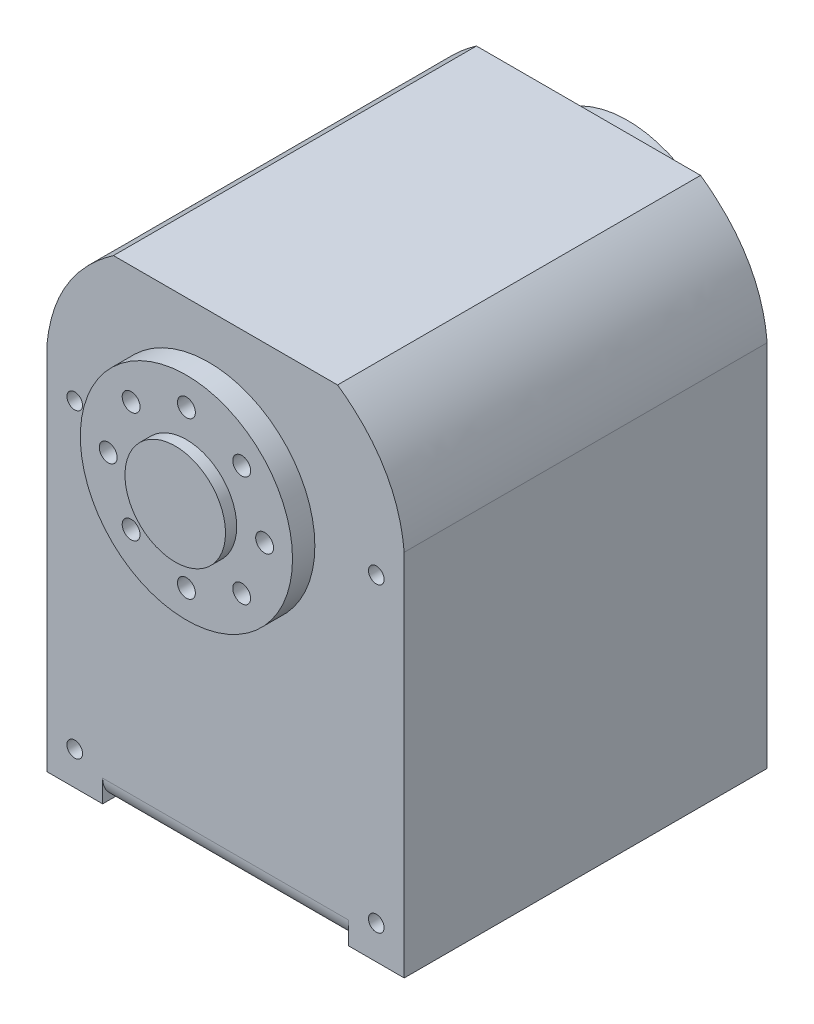
from build123d import *

# Parameters (mm, degrees)
ESQUISSE2_W             = 32
ESQUISSE2_H             = 43
BOSS_EXTRU_1_DEPTH      = 32.5
ESQUISSE3_R             = 0.7
ENL_V_MAT_EXTRU_1_DEPTH = 43.12481454
ESQUISSE4_R             = 4.5
BOSS_EXTRU_2_DEPTH      = 1.5
ESQUISSE5_R             = 9.5
ESQUISSE5_R_2           = 0.004347537
BOSS_EXTRU_3_DEPTH      = 2
ESQUISSE6_R             = 0.8
ENL_V_MAT_EXTRU_2_DEPTH = 2
ESQUISSE7_R             = 4.5
BOSS_EXTRU_4_DEPTH      = 1
ENL_V_MAT_EXTRU_4_DEPTH = 43.12481454
ENL_V_START             = -5
ENL_V_MAT_EXTRU_5_DEPTH = 22


with BuildPart() as part:
    # Esquisse2 → Boss.-Extru.1 (new body)
    with BuildSketch(Plane.XY):
        Rectangle(ESQUISSE2_W, ESQUISSE2_H)
    extrude(amount=BOSS_EXTRU_1_DEPTH)

    # Esquisse3 → Enlèv. mat.-Extru.1 (cut, through all)
    with BuildSketch(Plane.XY.offset(32.5)):
        with Locations((-13.5, -18.5)):
            Circle(ESQUISSE3_R)
        with Locations((-13.5, 8.5)):
            Circle(ESQUISSE3_R)
        with Locations(Location((13.5, 8.5, 0), (0, 0, 180))):
            Circle(ESQUISSE3_R)
        with Locations(Location((13.5, -18.5, 0), (0, 0, 180))):
            Circle(ESQUISSE3_R)
    extrude(amount=-ENL_V_MAT_EXTRU_1_DEPTH, mode=Mode.SUBTRACT)

    # Esquisse4 → Boss.-Extru.2 (add)
    with BuildSketch(Plane.XY.offset(32.5)):
        with Locations((0, 9.5)):
            Circle(ESQUISSE4_R)
    boss_extru_2 = extrude(amount=BOSS_EXTRU_2_DEPTH)

    # Esquisse5 → Boss.-Extru.3 (add)
    with BuildSketch(Plane.XY.offset(34)):
        with Locations((0, 9.5)):
            Circle(ESQUISSE5_R)
        with Locations((-2.77085543, 1.343871271)):
            Circle(ESQUISSE5_R_2, mode=Mode.SUBTRACT)
    boss_extru_3 = extrude(amount=BOSS_EXTRU_3_DEPTH)

    # Esquisse6 → Enlèv. mat.-Extru.2 (cut)
    with BuildSketch(Plane.XY.offset(36)):
        with Locations((-7, 9.5)):
            Circle(ESQUISSE6_R)
        with Locations((-4.949747468, 14.449747468)):
            Circle(ESQUISSE6_R)
        with Locations((0, 16.5)):
            Circle(ESQUISSE6_R)
        with Locations((4.949747468, 14.449747468)):
            Circle(ESQUISSE6_R)
        with Locations((7, 9.5)):
            Circle(ESQUISSE6_R)
        with Locations((4.949747468, 4.550252532)):
            Circle(ESQUISSE6_R)
        with Locations((0, 2.5)):
            Circle(ESQUISSE6_R)
        with Locations((-4.949747468, 4.550252532)):
            Circle(ESQUISSE6_R)
    enl_v_mat_extru_2 = extrude(amount=-ENL_V_MAT_EXTRU_2_DEPTH, mode=Mode.SUBTRACT)

    # Esquisse7 → Boss.-Extru.4 (add)
    with BuildSketch(Plane.XY.offset(36)):
        with Locations((0, 9.5)):
            Circle(ESQUISSE7_R)
    boss_extru_4 = extrude(amount=BOSS_EXTRU_4_DEPTH)

    # Esquisse10 → Enlèv. mat.-Extru.4 (cut, through all)
    with BuildSketch(Plane.XY.offset(32.5)):
        with BuildLine():
            add(Edge.make_bspline(
                [(-16, 11.510544327), (-15.437884563, 17.715114653), (-10.032085652, 21.5)],
                knots=[0.188379191, 0.188379191, 0.188379191, 1, 1, 1], degree=2))
            Line((-10.032085652, 21.5), (-16, 21.5))
            Line((-16, 21.5), (-16, 11.510544327))
        make_face()
        with BuildLine():
            Line((16, 21.5), (10.032085652, 21.5))
            add(Edge.make_bspline(
                [(16, 11.510544327), (15.437884563, 17.715114653), (10.032085652, 21.5)],
                knots=[0.188379191, 0.188379191, 0.188379191, 1, 1, 1], degree=2))
            Line((16, 11.510544327), (16, 21.5))
        make_face()
    extrude(amount=-ENL_V_MAT_EXTRU_4_DEPTH, mode=Mode.SUBTRACT)

    # Esquisse14 → Enlèv. mat.-Extru.5 (cut)
    with BuildSketch(Plane.ZY.offset(16).offset(ENL_V_START)):
        with BuildLine():
            Line((0, -19.5), (0, -21.5))
            Line((0, -21.5), (2, -21.5))
            ThreePointArc((2, -21.5), (0.585786438, -20.914213562), (0, -19.5))
        make_face()
        with BuildLine():
            Line((32.5, -19.5), (32.5, -21.5))
            Line((32.5, -21.5), (30.5, -21.5))
            ThreePointArc((30.5, -21.5), (31.914213562, -20.914213562), (32.5, -19.5))
        make_face()
    extrude(amount=-ENL_V_MAT_EXTRU_5_DEPTH, mode=Mode.SUBTRACT)

    # Symétrie1: Boss.-Extru.2, Boss.-Extru.3, Enlèv. mat.-Extru.2, Boss.-Extru.4 across plane
    add(boss_extru_2.mirror(Plane.XY.offset(16.25)))
    add(boss_extru_3.mirror(Plane.XY.offset(16.25)))
    add(enl_v_mat_extru_2.mirror(Plane.XY.offset(16.25)), mode=Mode.SUBTRACT)
    add(boss_extru_4.mirror(Plane.XY.offset(16.25)))


solid = part.part
